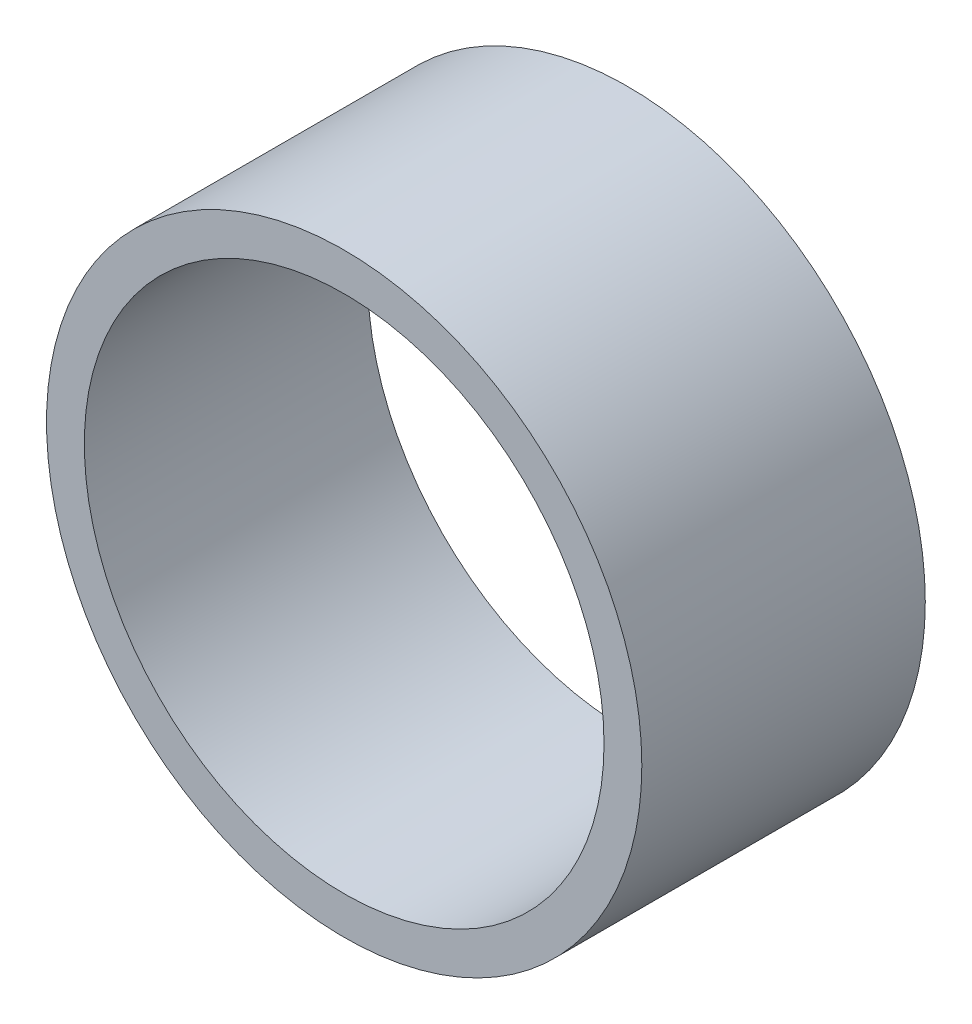
from build123d import *

# Parameters (mm, degrees)
SKETCH1_R           = 3.15
SKETCH1_R_2         = 2.75
BOSS_EXTRUDE1_DEPTH = 3


with BuildPart() as part:
    # Sketch1 → Boss-Extrude1 (new body)
    with BuildSketch(Plane.XY):
        Circle(SKETCH1_R)
        Circle(SKETCH1_R_2, mode=Mode.SUBTRACT)
    extrude(amount=BOSS_EXTRUDE1_DEPTH)


solid = part.part
